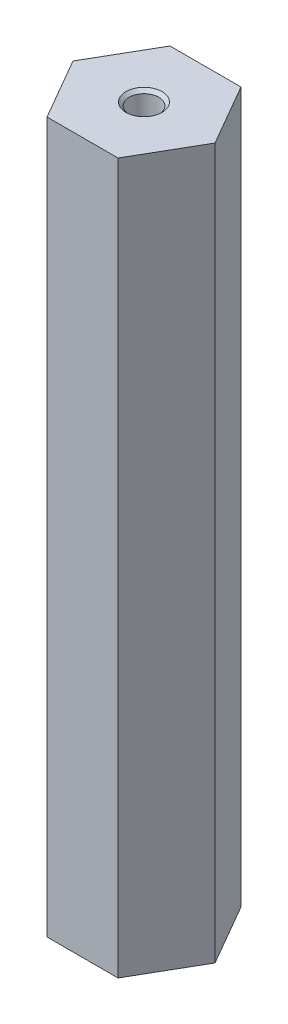
from build123d import *

# Parameters (mm, degrees)
EXTRUDE_1_DEPTH              = 60
HOLE_WIZARD_M3_1_D           = 2.5
HOLE_WIZARD_M3_1_CSINK_D     = 3.05
HOLE_WIZARD_M3_1_CSINK_ANGLE = 90


with BuildPart() as part:
    # 草图1 → 凸台-拉伸1 (new body)
    with BuildSketch(Plane(origin=(0, 0, 0), x_dir=(1, 0, 0), z_dir=(0, 1, 0))):
        Polygon((6, 0), (3, 5.196152423), (-3, 5.196152423), (-6, 0), (-3, -5.196152423), (3, -5.196152423), align=None)
    extrude(amount=EXTRUDE_1_DEPTH)

    # M3 螺纹孔1 (through all)
    with Locations(Plane(origin=(0, 60, 0), x_dir=(1, 0, 0), z_dir=(0, 1, 0))):
        with Locations((0, 0)):
            CounterSinkHole(HOLE_WIZARD_M3_1_D / 2, HOLE_WIZARD_M3_1_CSINK_D / 2, counter_sink_angle=HOLE_WIZARD_M3_1_CSINK_ANGLE)


solid = part.part
